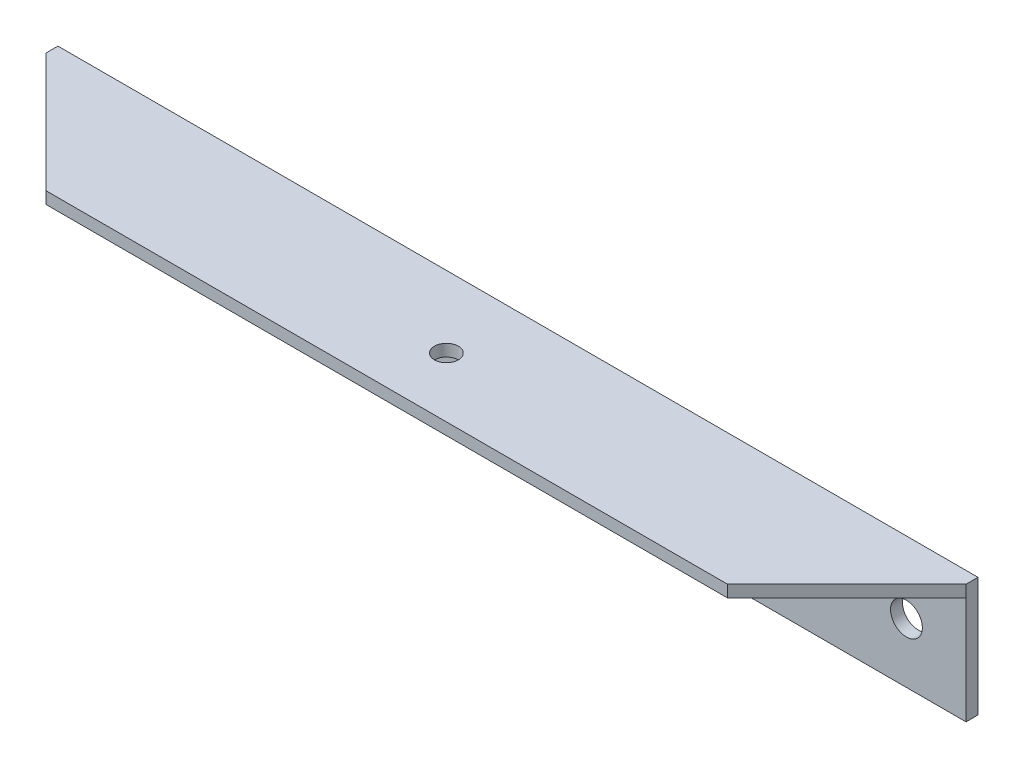
from build123d import *

# Parameters (mm, degrees)
SKETCH1_W                  = 231.4
SKETCH1_H                  = 30
BOSS_EXTRUDE1_DEPTH        = 3
BOSS_EXTRUDE2_DEPTH        = 3
F_8_0_8_DIAMETER_HOLE1_D   = 8
F_10_0_10_DIAMETER_HOLE1_D = 10
F_6_0_6_DIAMETER_HOLE1_D   = 6


with BuildPart() as part:
    # Sketch1 → Boss-Extrude1 (new body)
    with BuildSketch(Plane.XY):
        with Locations((0, -15)):
            Rectangle(SKETCH1_W, SKETCH1_H)
    extrude(amount=BOSS_EXTRUDE1_DEPTH)

    # Sketch2 → Boss-Extrude2 (add)
    with BuildSketch(Plane(origin=(0, 0, 0), x_dir=(1, 0, 0), z_dir=(0, 1, 0))):
        Polygon((-115.7, -3), (115.7, -3), (85.7, -33), (-85.7, -33), align=None)
    extrude(amount=-BOSS_EXTRUDE2_DEPTH)

    # Ø8.0 (8) Diameter Hole1 (through all)
    with Locations(Plane(origin=(0, 0, 0), x_dir=(-1, 0, 0), z_dir=(0, 0, -1))):
        with Locations((-100.7, -15), (100.7, -15)):
            Hole(F_8_0_8_DIAMETER_HOLE1_D / 2)

    # Ø10.0 (10) Diameter Hole1 (through all)
    with Locations(Plane(origin=(0, 0, 0), x_dir=(-1, 0, 0), z_dir=(0, 0, -1))):
        with Locations((62.5, -15)):
            Hole(F_10_0_10_DIAMETER_HOLE1_D / 2)

    # Ø6.0 (6) Diameter Hole1 (through all)
    with Locations(Plane(origin=(0, 0, 0), x_dir=(1, 0, 0), z_dir=(0, 1, 0))):
        with Locations((0, -18)):
            Hole(F_6_0_6_DIAMETER_HOLE1_D / 2)


solid = part.part
